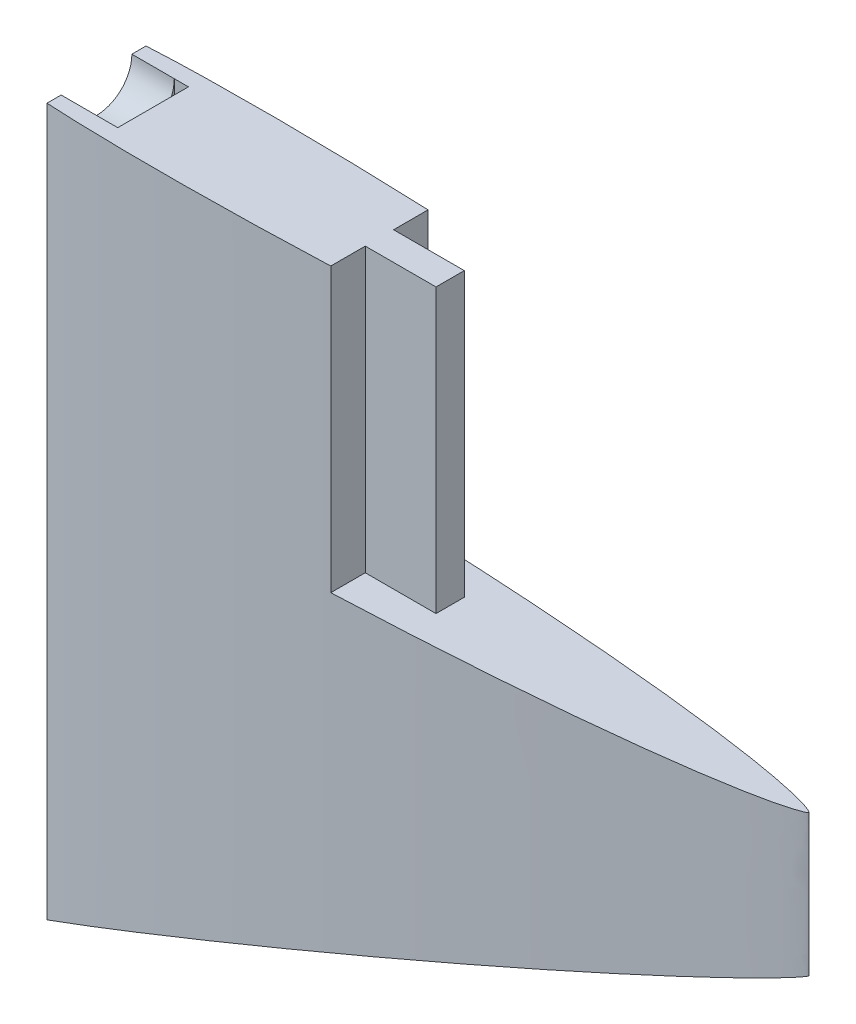
from build123d import *

# Parameters (mm, degrees)
EXTRUDE_2_DEPTH          = 100
CUT_EXTRUDE_1_DEPTH      = 100
CUT_EXTRUDE_1_DEPTH_BACK = 100
CUT_EXTRUDE_2_DEPTH      = 10
CUT_EXTRUDE_2_DEPTH_BACK = 10
SKETCH_8_R               = 2.5
CUT_EXTRUDE_3_DEPTH      = 4
CUT_EXTRUDE_START        = 30
SKETCH_9_W               = 1
SKETCH_9_H               = 5
CUT_EXTRUDE_4_DEPTH      = 20
EXTRUDE_START            = 30
SKETCH_11_W              = 5
SKETCH_11_H              = 2
EXTRUDE_4_DEPTH          = 20


with BuildPart() as part:
    # 草图1 → 凸台-拉伸2 (new body)
    with BuildSketch(Plane(origin=(0, 0, 0), x_dir=(1, 0, 0), z_dir=(0, 1, 0))):
        with BuildLine():
            Line((0, 3.5), (0, -3.5))
            add(Edge.make_bspline(
                [(50.366159274, 0), (50.361611856, -0.007626809), (50.351204479, -0.02006437), (50.331882619, -0.034590016), (50.303550644, -0.054206105), (50.267550201, -0.075556608), (50.212502865, -0.10497516), (50.119653298, -0.148566943), (49.957819519, -0.214752734), (49.665215675, -0.317523283), (49.13925125, -0.473472151), (48.270224034, -0.688745908), (46.70823084, -1.011640024), (44.506574683, -1.380432353), (41.778946661, -1.759931683), (38.652126132, -2.124759538), (35.514265565, -2.438710467), (32.372435692, -2.710036408), (29.227679081, -2.944564854), (26.08060135, -3.145565261), (22.931686571, -3.315201685), (19.781279338, -3.454355095), (16.629676417, -3.563265326), (13.477153227, -3.64092263), (10.32396772, -3.685707952), (7.170479651, -3.693560136), (4.194558842, -3.660897819), (2.007697821, -3.59990808), (0.60968903, -3.538531774), (0, -3.5)],
                knots=[0, 0, 0, 0, 0, 0.00069899, 0.001287975, 0.00188024, 0.002733393, 0.003996075, 0.006218737, 0.009974212, 0.016536224, 0.028474968, 0.049524397, 0.080651233, 0.142462147, 0.204715828, 0.26696952, 0.329223211, 0.391476901, 0.453730594, 0.515984286, 0.578237977, 0.640491669, 0.70274536, 0.764999052, 0.827252742, 0.889506435, 0.951760127, 1, 1, 1, 1, 1], degree=4))
            add(Edge.make_bspline(
                [(50.366159274, 0), (50.361611856, 0.007626809), (50.351204479, 0.02006437), (50.331882619, 0.034590016), (50.303550644, 0.054206105), (50.267550201, 0.075556608), (50.212502865, 0.10497516), (50.119653298, 0.148566943), (49.957819519, 0.214752734), (49.665215675, 0.317523283), (49.13925125, 0.473472151), (48.270224034, 0.688745908), (46.70823084, 1.011640024), (44.506574683, 1.380432353), (41.778946661, 1.759931683), (38.652126132, 2.124759538), (35.514265565, 2.438710467), (32.372435692, 2.710036408), (29.227679081, 2.944564854), (26.08060135, 3.145565261), (22.931686571, 3.315201685), (19.781279338, 3.454355095), (16.629676417, 3.563265326), (13.477153227, 3.64092263), (10.32396772, 3.685707952), (7.170479651, 3.693560136), (4.194558842, 3.660897819), (2.007697821, 3.59990808), (0.60968903, 3.538531774), (0, 3.5)],
                knots=[0, 0, 0, 0, 0, 0.00069899, 0.001287975, 0.00188024, 0.002733393, 0.003996075, 0.006218737, 0.009974212, 0.016536224, 0.028474968, 0.049524397, 0.080651233, 0.142462147, 0.204715828, 0.26696952, 0.329223211, 0.391476901, 0.453730594, 0.515984286, 0.578237977, 0.640491669, 0.70274536, 0.764999052, 0.827252742, 0.889506435, 0.951760127, 1, 1, 1, 1, 1], degree=4))
        make_face()
    extrude(amount=EXTRUDE_2_DEPTH)

    # 草图3 → 切除-拉伸1 (cut, two sides: drawn at the far end of the back side and taken through both)
    with BuildSketch(Plane.XY.offset(-CUT_EXTRUDE_1_DEPTH_BACK)):
        Polygon((50.366159274, 100), (50.366159274, 80), (0, 100), align=None)
        Polygon((50.366159274, 0), (50.366159274, 20), (0, 0), align=None)
    extrude(amount=CUT_EXTRUDE_1_DEPTH + CUT_EXTRUDE_1_DEPTH_BACK, mode=Mode.SUBTRACT)

    # 草图7 → 切除-拉伸2 (cut, two sides: drawn at the far end of the back side and taken through both)
    with BuildSketch(Plane.XY.offset(-CUT_EXTRUDE_2_DEPTH_BACK)):
        Polygon((0, 50), (20, 50), (20, 30), (50.366159274, 30), (50.366159274, 80), (0, 100), align=None)
    extrude(amount=CUT_EXTRUDE_2_DEPTH + CUT_EXTRUDE_2_DEPTH_BACK, mode=Mode.SUBTRACT)

    # 草图8 → 切除-拉伸3 (cut)
    with BuildSketch(Plane(origin=(0, 0, 0), x_dir=(0, 0, -1), z_dir=(1, 0, 0))):
        with Locations((0, 50)):
            Circle(SKETCH_8_R)
    extrude(amount=CUT_EXTRUDE_3_DEPTH, mode=Mode.SUBTRACT)

    # 草图9 → 切除-拉伸4 (cut)
    with BuildSketch(Plane(origin=(0, 0, 0), x_dir=(1, 0, 0), z_dir=(0, 1, 0)).offset(CUT_EXTRUDE_START)):
        with Locations((3.5, 0)):
            Rectangle(SKETCH_9_W, SKETCH_9_H)
    extrude(amount=CUT_EXTRUDE_4_DEPTH, mode=Mode.SUBTRACT)

    # 草图11 → 凸台-拉伸4 (add)
    with BuildSketch(Plane(origin=(0, 0, 0), x_dir=(1, 0, 0), z_dir=(0, 1, 0)).offset(EXTRUDE_START)):
        with Locations((22.5, 0)):
            Rectangle(SKETCH_11_W, SKETCH_11_H)
    extrude(amount=EXTRUDE_4_DEPTH)


solid = part.part
